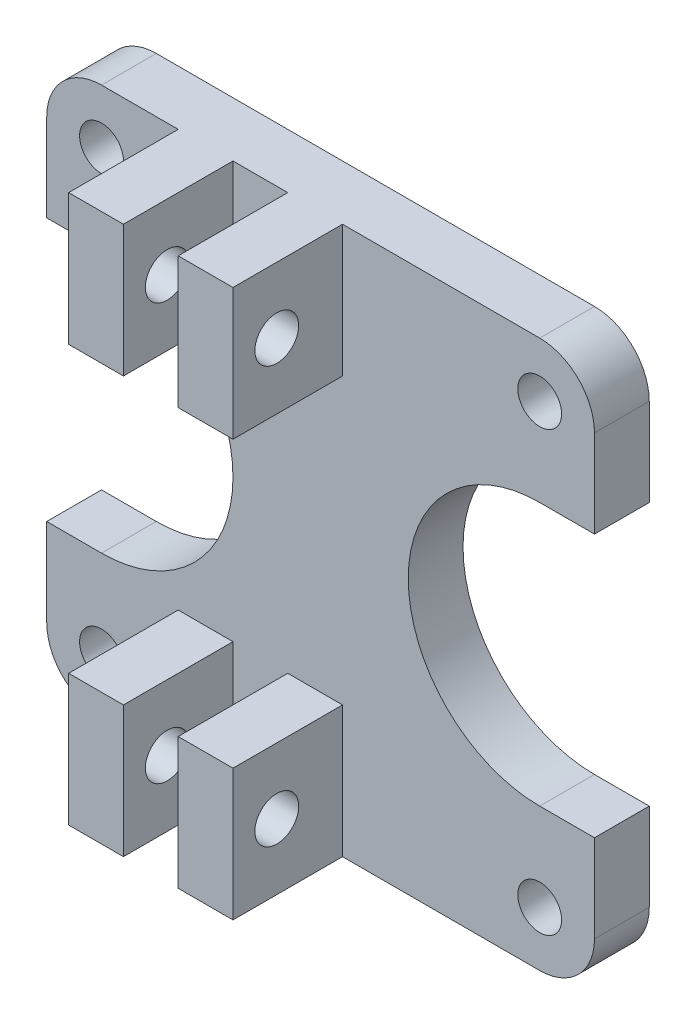
from build123d import *

# Parameters (mm, degrees)
SKETCH_1_R          = 2
EXTRUDE_1_DEPTH     = 2.5
FILLET_1_R          = 5
SKETCH_2_W          = 5
SKETCH_2_H          = 12
EXTRUDE_2_DEPTH     = 10
SKETCH_3_R          = 2
CUT_EXTRUDE_1_DEPTH = 48.172555581


with BuildPart() as part:
    # 草图1 → 凸台-拉伸1 (new, symmetric)
    with BuildSketch(Plane.XY):
        with BuildLine():
            Line((-25, -25), (25, -25))
            Line((25, -25), (25, -12))
            Line((25, -12), (20, -12))
            ThreePointArc((20, -12), (8, 0), (20, 12))
            Line((20, 12), (25, 12))
            Line((25, 12), (25, 25))
            Line((25, 25), (-25, 25))
            Line((-25, 25), (-25, 12))
            Line((-25, 12), (-20, 12))
            ThreePointArc((-20, 12), (-8, 0), (-20, -12))
            Line((-20, -12), (-25, -12))
            Line((-25, -12), (-25, -25))
        make_face()
        with Locations((-20, 20)):
            Circle(SKETCH_1_R, mode=Mode.SUBTRACT)
        with Locations((-20, -20)):
            Circle(SKETCH_1_R, mode=Mode.SUBTRACT)
        with Locations((20, 20)):
            Circle(SKETCH_1_R, mode=Mode.SUBTRACT)
        with Locations((20, -20)):
            Circle(SKETCH_1_R, mode=Mode.SUBTRACT)
    extrude(amount=EXTRUDE_1_DEPTH, both=True)

    # 圆角1
    fillet_1_edges = [part.edges().sort_by_distance(p)[0] for p in [
        (-25, 25, 0),
        (25, 25, 0),
        (25, -25, 0),
        (-25, -25, 0),
    ]]
    fillet(fillet_1_edges, radius=FILLET_1_R)

    # 草图2 → 凸台-拉伸2 (add)
    with BuildSketch(Plane.XY.offset(2.5)):
        with Locations((-10.5, 19)):
            Rectangle(SKETCH_2_W, SKETCH_2_H)
        with Locations((-0.5, -19)):
            Rectangle(SKETCH_2_W, SKETCH_2_H)
        with Locations((-0.5, 19)):
            Rectangle(SKETCH_2_W, SKETCH_2_H)
        with Locations((-10.5, -19)):
            Rectangle(SKETCH_2_W, SKETCH_2_H)
    extrude(amount=EXTRUDE_2_DEPTH)

    # 草图3 → 切除-拉伸1 (cut, through all)
    with BuildSketch(Plane.ZY.offset(13)):
        with Locations(Location((8.5, 19, 0), (0, 0, 270))):
            Circle(SKETCH_3_R)
        with Locations(Location((8.5, -19, 0), (0, 0, 270))):
            Circle(SKETCH_3_R)
    extrude(amount=-CUT_EXTRUDE_1_DEPTH, mode=Mode.SUBTRACT)


solid = part.part
